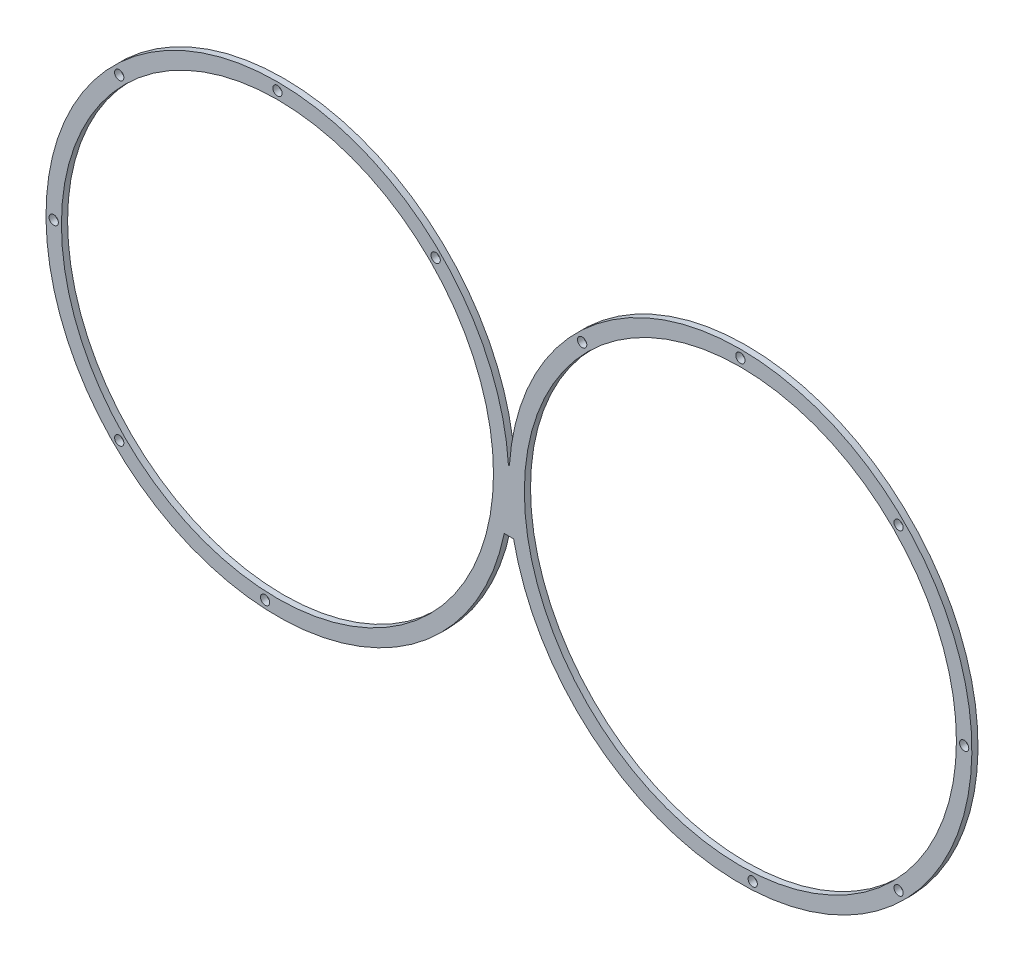
from build123d import *

# Parameters (mm, degrees)
SKETCH_2_R      = 1.5
EXTRUDE_2_DEPTH = 2


with BuildPart() as part:
    # 草图2 → 凸台-拉伸2 (new body)
    with BuildSketch(Plane.XY):
        with BuildLine():
            ThreePointArc((-51.905600365, 30), (-201.574285493, 30.30226796), (-53.265307717, 10.171351817))
            Line((-53.265307717, 10.171351817), (-50.234692283, 10.171351817))
            ThreePointArc((-50.234692283, 10.171351817), (98.074285493, 30.30226796), (-51.594399635, 30))
            Line((-51.594399635, 30), (-51.905600365, 30))
        make_face()
        with Locations((-130.75, -47.218219255)):
            Circle(SKETCH_2_R, mode=Mode.SUBTRACT)
        with Locations((-178.015241636, -26.093889819)):
            Circle(SKETCH_2_R, mode=Mode.SUBTRACT)
        with Locations((27.25, -47.218219255)):
            Circle(SKETCH_2_R, mode=Mode.SUBTRACT)
        with Locations((74.515241636, -26.093889819)):
            Circle(SKETCH_2_R, mode=Mode.SUBTRACT)
        with Locations((-199.25, 25.171351817)):
            Circle(SKETCH_2_R, mode=Mode.SUBTRACT)
        with BuildLine():
            ThreePointArc((-56.757143222, 26.171351817), (-56.751785828, 25.671364573), (-56.75, 25.171351817))
            ThreePointArc((-56.75, 25.171351817), (-56.751785828, 24.671339061), (-56.757143222, 24.171351817))
            ThreePointArc((-56.757143222, 24.171351817), (-62.078432724, -1.616488449), (-76.550469556, -23.613965065))
            ThreePointArc((-76.550469556, -23.613965065), (-77.252525317, -24.326122866), (-77.964683119, -25.028178627))
            ThreePointArc((-77.964683119, -25.028178627), (-99.962159734, -39.500215459), (-125.75, -44.821504962))
            ThreePointArc((-125.75, -44.821504962), (-126.75, -44.828648183), (-127.75, -44.821504962))
            ThreePointArc((-127.75, -44.821504962), (-153.537840266, -39.500215459), (-175.535316881, -25.028178627))
            ThreePointArc((-175.535316881, -25.028178627), (-176.247474683, -24.326122866), (-176.949530444, -23.613965065))
            ThreePointArc((-176.949530444, -23.613965065), (-191.421567276, -1.616488449), (-196.742856778, 24.171351817))
            ThreePointArc((-196.742856778, 24.171351817), (-196.75, 25.171351817), (-196.742856778, 26.171351817))
            ThreePointArc((-196.742856778, 26.171351817), (-191.421567276, 51.959192082), (-176.949530444, 73.956668698))
            ThreePointArc((-176.949530444, 73.956668698), (-176.247474683, 74.6688265), (-175.535316881, 75.370882261))
            ThreePointArc((-175.535316881, 75.370882261), (-153.537840266, 89.842919093), (-127.75, 95.164208595))
            ThreePointArc((-127.75, 95.164208595), (-126.75, 95.171351817), (-125.75, 95.164208595))
            ThreePointArc((-125.75, 95.164208595), (-99.962159734, 89.842919093), (-77.964683119, 75.370882261))
            ThreePointArc((-77.964683119, 75.370882261), (-77.252525317, 74.6688265), (-76.550469556, 73.956668698))
            ThreePointArc((-76.550469556, 73.956668698), (-62.078432724, 51.959192082), (-56.757143222, 26.171351817))
        make_face(mode=Mode.SUBTRACT)
        with Locations((-178.015241636, 76.436593453)):
            Circle(SKETCH_2_R, mode=Mode.SUBTRACT)
        with Locations((-75.484758364, 76.436593453)):
            Circle(SKETCH_2_R, mode=Mode.SUBTRACT)
        with Locations((-126.75, 97.671351817)):
            Circle(SKETCH_2_R, mode=Mode.SUBTRACT)
        with BuildLine():
            ThreePointArc((93.242856778, 26.171351817), (93.248214172, 25.671364573), (93.25, 25.171351817))
            ThreePointArc((93.25, 25.171351817), (93.248214172, 24.671339061), (93.242856778, 24.171351817))
            ThreePointArc((93.242856778, 24.171351817), (87.921567276, -1.616488449), (73.449530444, -23.613965065))
            ThreePointArc((73.449530444, -23.613965065), (72.747474683, -24.326122866), (72.035316881, -25.028178627))
            ThreePointArc((72.035316881, -25.028178627), (50.037840266, -39.500215459), (24.25, -44.821504962))
            ThreePointArc((24.25, -44.821504962), (23.25, -44.828648183), (22.25, -44.821504962))
            ThreePointArc((22.25, -44.821504962), (-3.537840266, -39.500215459), (-25.535316881, -25.028178627))
            ThreePointArc((-25.535316881, -25.028178627), (-26.247474683, -24.326122866), (-26.949530444, -23.613965065))
            ThreePointArc((-26.949530444, -23.613965065), (-41.421567276, -1.616488449), (-46.742856778, 24.171351817))
            ThreePointArc((-46.742856778, 24.171351817), (-46.75, 25.171351817), (-46.742856778, 26.171351817))
            ThreePointArc((-46.742856778, 26.171351817), (-41.421567276, 51.959192082), (-26.949530444, 73.956668698))
            ThreePointArc((-26.949530444, 73.956668698), (-26.247474683, 74.6688265), (-25.535316881, 75.370882261))
            ThreePointArc((-25.535316881, 75.370882261), (-3.537840266, 89.842919093), (22.25, 95.164208595))
            ThreePointArc((22.25, 95.164208595), (23.25, 95.171351817), (24.25, 95.164208595))
            ThreePointArc((24.25, 95.164208595), (50.037840266, 89.842919093), (72.035316881, 75.370882261))
            ThreePointArc((72.035316881, 75.370882261), (72.747474683, 74.6688265), (73.449530444, 73.956668698))
            ThreePointArc((73.449530444, 73.956668698), (87.921567276, 51.959192082), (93.242856778, 26.171351817))
        make_face(mode=Mode.SUBTRACT)
        with Locations((95.75, 25.171351817)):
            Circle(SKETCH_2_R, mode=Mode.SUBTRACT)
        with Locations((-28.015241636, 76.436593453)):
            Circle(SKETCH_2_R, mode=Mode.SUBTRACT)
        with Locations((23.25, 97.671351817)):
            Circle(SKETCH_2_R, mode=Mode.SUBTRACT)
        with Locations((74.515241636, 76.436593453)):
            Circle(SKETCH_2_R, mode=Mode.SUBTRACT)
    extrude(amount=EXTRUDE_2_DEPTH)


solid = part.part
